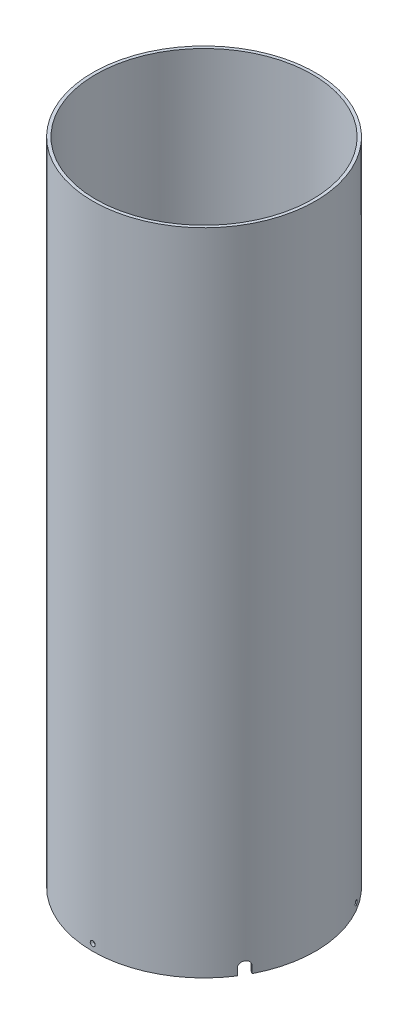
from build123d import *

# Parameters (mm, degrees)
SKETCH1_R               = 78.359
SKETCH1_R_2             = 76.2
BOSS_EXTRUDE1_DEPTH     = 457.2
SKETCH2_R               = 1.750000056
CUT_EXTRUDE1_DEPTH      = 471.438206104
CIRPATTERN1_COUNT       = 6
CUT_EXTRUDE2_REACH      = 491.625
CUT_EXTRUDE2_END_RADIUS = 76.2
CIRPATTERN2_COUNT       = 3


with BuildPart() as part:
    # Sketch1 → Boss-Extrude1 (new body)
    with BuildSketch(Plane(origin=(0, 0, 0), x_dir=(1, 0, 0), z_dir=(0, 1, 0))):
        with Locations(Location((0, 0, 0), (0, 0, 270))):
            Circle(SKETCH1_R)
        with Locations(Location((0, 0, 0), (0, 0, 270))):
            Circle(SKETCH1_R_2, mode=Mode.SUBTRACT)
    extrude(amount=BOSS_EXTRUDE1_DEPTH)

    # Sketch2 → Cut-Extrude1 (cut, through all)
    with BuildSketch(Plane.XY):
        with Locations(Location((0, 4.7625, 0), (0, 0, 90))):
            Circle(SKETCH2_R)
    cut_extrude1 = extrude(amount=-CUT_EXTRUDE1_DEPTH, mode=Mode.SUBTRACT)

    # CirPattern1: Cut-Extrude1 ×6 about axis
    cirpattern1_axis = Axis((0, 457.2, 0), (0, -1, 0))
    for i in range(1, CIRPATTERN1_COUNT):
        add(cut_extrude1.rotate(cirpattern1_axis, i * 360 / CIRPATTERN1_COUNT), mode=Mode.SUBTRACT)

    # Cut-Extrude2: up to this cylinder (the profile starts outside it)
    cut_extrude2_end = Plane(origin=(0, 3.909431, 0), z_dir=(0, -1, 0)) * Cylinder(CUT_EXTRUDE2_END_RADIUS, 1136.65, mode=Mode.PRIVATE)
    # Sketch3 → Cut-Extrude2 (cut, up to the surface)
    with BuildSketch(Plane(origin=(0, 0, -78.359), x_dir=(-1, 0, 0), z_dir=(0, 0, -1)), mode=Mode.PRIVATE) as cut_extrude2_sk1:
        with BuildLine():
            Line((-3.81, 4.732887187), (-3.81, 0))
            Line((-3.81, 0), (3.81, 0))
            Line((3.81, 0), (3.81, 4.732887187))
            ThreePointArc((3.81, 4.732887187), (0, 8.542887187), (-3.81, 4.732887187))
        make_face()
    cut_extrude2_tool1 = extrude(cut_extrude2_sk1.sketch, amount=-CUT_EXTRUDE2_REACH, mode=Mode.PRIVATE) - cut_extrude2_end
    cut_extrude2 = cut_extrude2_tool1.solids().sort_by_distance((0, 3.909431, -78.359))[0]
    add(cut_extrude2, mode=Mode.SUBTRACT)

    # CirPattern2: Cut-Extrude2 ×3 about axis
    cirpattern2_axis = Axis((0, 0, 0), (0, 1, 0))
    for i in range(1, CIRPATTERN2_COUNT):
        add(cut_extrude2.rotate(cirpattern2_axis, i * 360 / CIRPATTERN2_COUNT), mode=Mode.SUBTRACT)


solid = part.part
